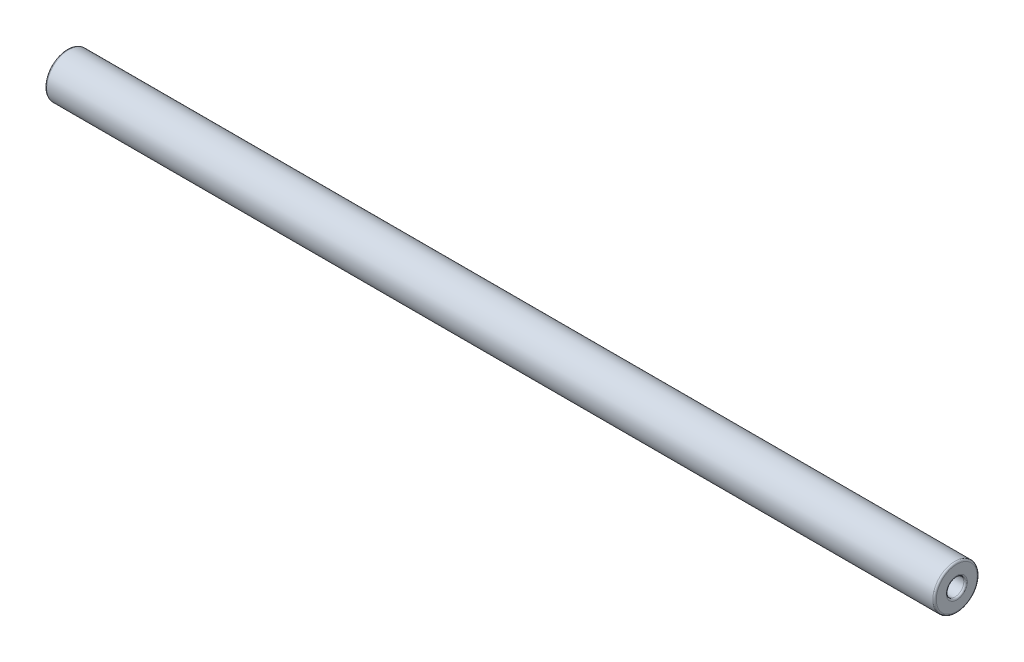
from build123d import *

# Parameters (mm, degrees)
SKETCH1_R           = 6.35
SKETCH1_R_2         = 2.5
BOSS_EXTRUDE1_DEPTH = 127
FILLET1_R           = 0.5


with BuildPart() as part:
    # Sketch1 → Boss-Extrude1 (new, symmetric)
    with BuildSketch(Plane(origin=(0, 0, 0), x_dir=(0, 0, -1), z_dir=(1, 0, 0))):
        Circle(SKETCH1_R)
        Circle(SKETCH1_R_2, mode=Mode.SUBTRACT)
    extrude(amount=BOSS_EXTRUDE1_DEPTH, both=True)

    # Fillet1
    fillet1_edges = [part.edges().sort_by_distance(p)[0] for p in [
        (-127, 0, 6.35),
        (127, 0, 6.35),
        (-127, 0, 2.5),
        (127, 0, 2.5),
    ]]
    fillet(fillet1_edges, radius=FILLET1_R)


solid = part.part
